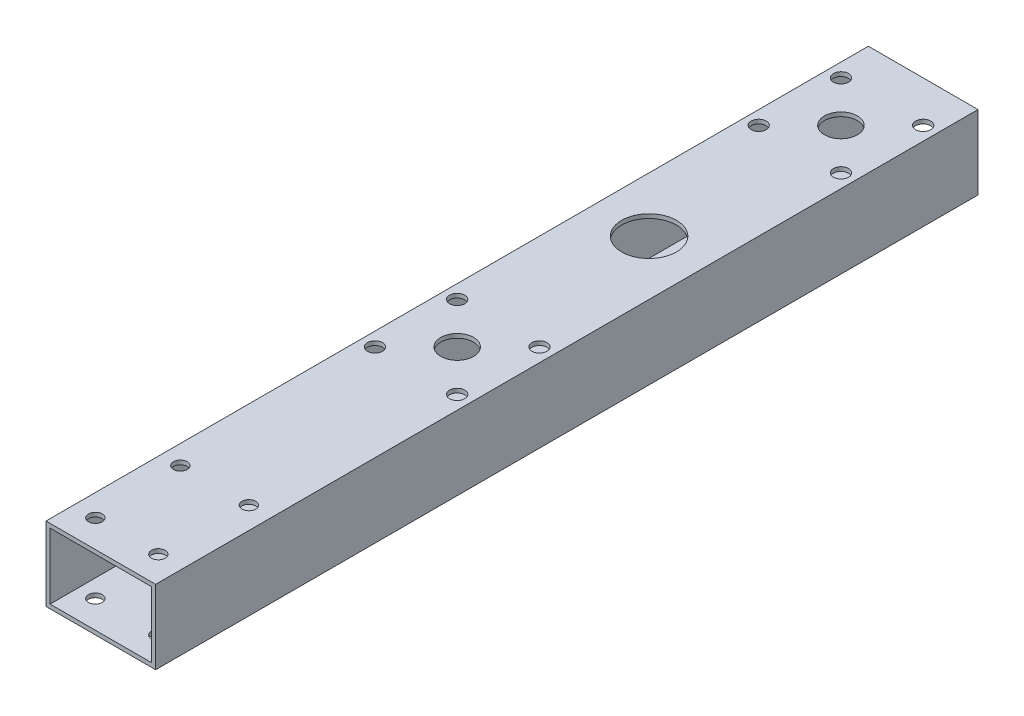
from build123d import *

# Parameters (mm, degrees)
ESQUISSE1_W             = 40
ESQUISSE1_H             = 27
ESQUISSE1_W_2           = 37
ESQUISSE1_H_2           = 24
BOSS_EXTRU_1_DEPTH      = 300
ESQUISSE2_R             = 2.5
ENL_V_MAT_EXTRU_1_DEPTH = 304.856874202
ESQUISSE3_R             = 6
ESQUISSE3_R_2           = 2.75
ESQUISSE3_R_3           = 10
ENL_V_MAT_EXTRU_2_DEPTH = 304.856874202


with BuildPart() as part:
    # Esquisse1 → Boss.-Extru.1 (new body)
    with BuildSketch(Plane.XY):
        with Locations((20, 13.5)):
            Rectangle(ESQUISSE1_W, ESQUISSE1_H)
        with Locations((20, 13.5)):
            Rectangle(ESQUISSE1_W_2, ESQUISSE1_H_2, mode=Mode.SUBTRACT)
    extrude(amount=BOSS_EXTRU_1_DEPTH)

    # Esquisse2 → Enlèv. mat.-Extru.1 (cut, through all)
    with BuildSketch(Plane(origin=(0, 0, 0), x_dir=(1, 0, 0), z_dir=(0, 1, 0))):
        with Locations(Location((8, -290, 0), (0, 0, 90))):
            Circle(ESQUISSE2_R)
        with Locations(Location((32, -258, 0), (0, 0, 90))):
            Circle(ESQUISSE2_R)
        with Locations(Location((7, -258, 0), (0, 0, 90))):
            Circle(ESQUISSE2_R)
        with Locations(Location((31, -290, 0), (0, 0, 90))):
            Circle(ESQUISSE2_R)
    extrude(amount=ENL_V_MAT_EXTRU_1_DEPTH, mode=Mode.SUBTRACT)

    # Esquisse3 → Enlèv. mat.-Extru.2 (cut, through all)
    with BuildSketch(Plane(origin=(0, 0, 0), x_dir=(1, 0, 0), z_dir=(0, 1, 0))):
        with Locations(Location((20, -30, 0), (0, 0, 90))):
            Circle(ESQUISSE3_R)
        with Locations(Location((5, -15, 0), (0, 0, 90))):
            Circle(ESQUISSE3_R_2)
        with Locations(Location((20, -100, 0), (0, 0, 90))):
            Circle(ESQUISSE3_R_3)
        with Locations(Location((35, -15, 0), (0, 0, 90))):
            Circle(ESQUISSE3_R_2)
        with Locations(Location((35, -45, 0), (0, 0, 90))):
            Circle(ESQUISSE3_R_2)
        with Locations(Location((5, -45, 0), (0, 0, 90))):
            Circle(ESQUISSE3_R_2)
        with Locations(Location((5, -185, 0), (0, 0, 90))):
            Circle(ESQUISSE3_R_2)
        with Locations(Location((35, -185, 0), (0, 0, 90))):
            Circle(ESQUISSE3_R_2)
        with Locations(Location((35, -155, 0), (0, 0, 90))):
            Circle(ESQUISSE3_R_2)
        with Locations(Location((20, -170, 0), (0, 0, 90))):
            Circle(ESQUISSE3_R)
        with Locations(Location((5, -155, 0), (0, 0, 90))):
            Circle(ESQUISSE3_R_2)
    extrude(amount=ENL_V_MAT_EXTRU_2_DEPTH, mode=Mode.SUBTRACT)


solid = part.part
